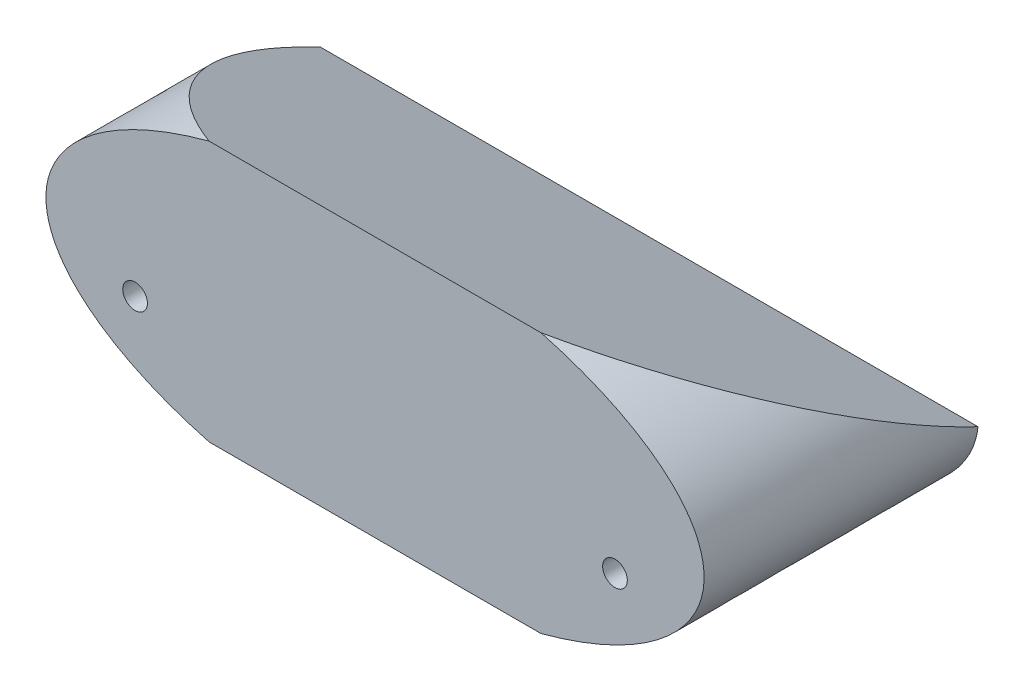
from build123d import *

# Parameters (mm, degrees)
SKETCH1_RX               = 240
SKETCH1_RY               = 110
BOSS_EXTRUDE1_DEPTH      = 200
SKETCH12_R               = 9
CUT_EXTRUDE8_DEPTH       = 332.209903234
CUT_EXTRUDE10_DEPTH      = 332.209903234
CUT_EXTRUDE10_DEPTH_BACK = 332.209903234
SKETCH15_W               = 200
SKETCH15_H               = 15


with BuildPart() as part:
    # Sketch1 → Boss-Extrude1 (new body)
    with BuildSketch(Plane.XY):
        with Locations((0, 0)):
            Ellipse(SKETCH1_RX, SKETCH1_RY)
    extrude(amount=-BOSS_EXTRUDE1_DEPTH)

    # Sketch12 → Cut-Extrude8 (cut, through all)
    with BuildSketch(Plane.XY):
        with Locations((175, -30)):
            Circle(SKETCH12_R)
        with Locations(Location((-175, -30, 0), (0, 0, 180))):
            Circle(SKETCH12_R)
    extrude(amount=-CUT_EXTRUDE8_DEPTH, mode=Mode.SUBTRACT)

    # Sketch15 → Cut-Extrude10 (cut, two sides: drawn at the far end of the back side and taken through both)
    with BuildSketch(Plane(origin=(0, 0, 0), x_dir=(0, 0, -1), z_dir=(1, 0, 0)).offset(-CUT_EXTRUDE10_DEPTH_BACK)):
        Polygon((0, 110), (0, 95), (200, -5), (200, 110), align=None)
        with Locations((100, -102.5)):
            Rectangle(SKETCH15_W, SKETCH15_H)
    extrude(amount=CUT_EXTRUDE10_DEPTH + CUT_EXTRUDE10_DEPTH_BACK, mode=Mode.SUBTRACT)


solid = part.part
